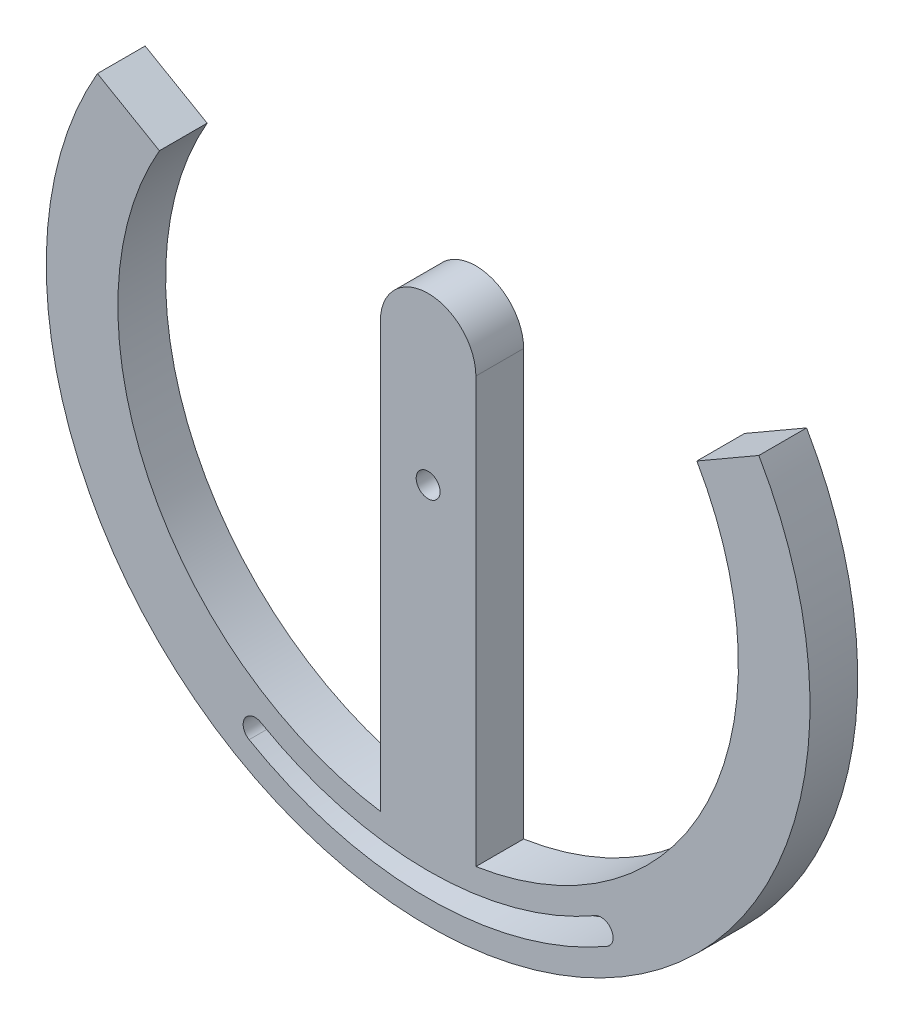
from build123d import *

# Parameters (mm, degrees)
SKETCH1_R         = 101.6
EXTRUDE1_DEPTH    = 12.7
SKETCH3_R         = 3.175
EXTRUDE3_DEPTH    = 145.244271983
SKETCH4_OUTSIDE_W = 262.73
SKETCH4_OUTSIDE_H = 262.73
EXTRUDE4_DEPTH    = 145.244271983


with BuildPart() as part:
    # Sketch1 → Extrude1 (new body)
    with BuildSketch(Plane.XY):
        Circle(SKETCH1_R)
    extrude(amount=EXTRUDE1_DEPTH)

    # Sketch3 → Extrude3 (cut, through all)
    with BuildSketch(Plane.XY.offset(12.7)):
        Circle(SKETCH3_R)
        with BuildLine():
            ThreePointArc((47.625, -82.48891971), (0, -95.25), (-47.625, -82.48891971))
            ThreePointArc((-47.625, -82.48891971), (-48.787130657, -78.151789053), (-44.45, -76.989658396))
            ThreePointArc((-44.45, -76.989658396), (0, -88.9), (44.45, -76.989658396))
            ThreePointArc((44.45, -76.989658396), (48.787130657, -78.151789053), (47.625, -82.48891971))
        make_face()
    extrude(amount=-EXTRUDE3_DEPTH, mode=Mode.SUBTRACT)

    # Sketch4 outside → Extrude4 (cut, through all)
    with BuildSketch(Plane.XY.offset(12.7)):
        Rectangle(SKETCH4_OUTSIDE_W, SKETCH4_OUTSIDE_H)
        with BuildLine():
            Line((-87.988181024, 50.8), (-71.490397082, 41.275))
            ThreePointArc((-71.490397082, 41.275), (-74.46179501, -35.636267817), (-12.7, -81.567226875))
            Line((-12.7, -81.567226875), (-12.7, 31.450356454))
            ThreePointArc((-12.7, 31.450356454), (0, 44.150356454), (12.7, 31.450356454))
            Line((12.7, 31.450356454), (12.7, -81.567226875))
            ThreePointArc((12.7, -81.567226875), (74.46179501, -35.636267817), (71.490397082, 41.275))
            Line((71.490397082, 41.275), (87.988181024, 50.8))
            ThreePointArc((87.988181024, 50.8), (0, -101.6), (-87.988181024, 50.8))
        make_face(mode=Mode.SUBTRACT)
    extrude(amount=-EXTRUDE4_DEPTH, mode=Mode.SUBTRACT)


solid = part.part
